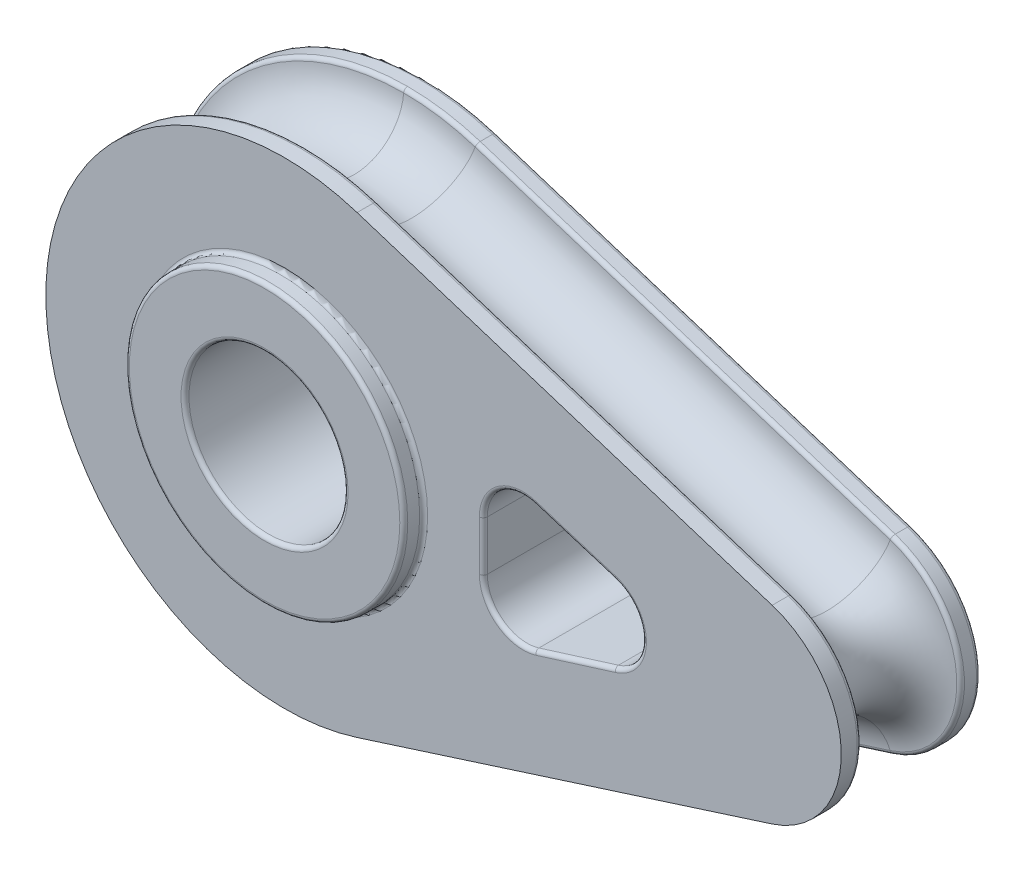
from build123d import *

# Parameters (mm, degrees)
SKETCH1_R           = 88.9
BOSS_EXTRUDE1_DEPTH = 44.45
SKETCH1_3_R         = 88.9
SKETCH1_3_R_2       = 50.8
BOSS_EXTRUDE2_DEPTH = 57.15
SKETCH5_R           = 31.75
FILLET1_R           = 2.54


with BuildPart() as part:
    # Sketch1 → Boss-Extrude1 (new, symmetric)
    with BuildSketch(Plane.XY):
        with BuildLine():
            Line((46.382608696, -145.170291763), (311.426086957, -60.487621568))
            ThreePointArc((311.426086957, -60.487621568), (355.6, 0), (311.426086957, 60.487621568))
            Line((311.426086957, 60.487621568), (46.382608696, 145.170291763))
            ThreePointArc((46.382608696, 145.170291763), (-152.4, 0), (46.382608696, -145.170291763))
        make_face()
        Circle(SKETCH1_R, mode=Mode.SUBTRACT)
        with BuildLine():
            Line((210.776184826, -24.243791442), (159.976184826, -40.118791442))
            ThreePointArc((159.976184826, -40.118791442), (137.354653453, -36.339543662), (127, -15.875))
            Line((127, -15.875), (127, 15.875))
            ThreePointArc((127, 15.875), (137.354653453, 36.339543662), (159.976184826, 40.118791442))
            Line((159.976184826, 40.118791442), (210.776184826, 24.243791442))
            ThreePointArc((210.776184826, 24.243791442), (228.6, 0), (210.776184826, -24.243791442))
        make_face(mode=Mode.SUBTRACT)
    extrude(amount=BOSS_EXTRUDE1_DEPTH, both=True)

    # Sketch1<3> → Boss-Extrude2 (add, symmetric)
    with BuildSketch(Plane.XY):
        Circle(SKETCH1_3_R)
        Circle(SKETCH1_3_R_2, mode=Mode.SUBTRACT)
    extrude(amount=BOSS_EXTRUDE2_DEPTH, both=True)

    # Cut-Sweep2: sweep along a curve in space
    with BuildLine() as cut_sweep2_path:
        Line((311.426086957, 60.487621568, 0), (46.382608696, 145.170291763, 0))
        ThreePointArc((46.382608696, 145.170291763, 0), (-152.4, 0, 0), (46.382608696, -145.170291763, 0))
        Line((46.382608696, -145.170291763, 0), (311.426086957, -60.487621568, 0))
        ThreePointArc((311.426086957, -60.487621568, 0), (355.6, 0, 0), (311.426086957, 60.487621568, 0))
    # Sketch5 → Cut-Sweep2 (sweep, cut)
    with BuildSketch(Plane(origin=(0, 0, 0), x_dir=(0, 0, -1), z_dir=(1, 0, 0))):
        with Locations((0, 152.4)):
            Circle(SKETCH5_R)
    sweep(path=cut_sweep2_path.line, mode=Mode.SUBTRACT)

    # Fillet1
    fillet1_edges = [part.edges().sort_by_distance(p)[0] for p in [
        (127, 0, 44.45),
        (-152.4, 0, -44.45),
        (178.904347826, 102.828956666, -44.45),
        (355.6, 0, -44.45),
        (178.904347826, -102.828956666, -44.45),
        (185.376184826, -32.181291442, -44.45),
        (137.354653453, 36.339543662, 44.45),
        (228.6, 0, -44.45),
        (185.376184826, 32.181291442, -44.45),
        (137.354653453, 36.339543662, -44.45),
        (127, 0, -44.45),
        (137.354653453, -36.339543662, -44.45),
        (185.376184826, 32.181291442, 44.45),
        (228.6, 0, 44.45),
        (185.376184826, -32.181291442, 44.45),
        (-88.9, 0, 44.45),
        (-88.9, 0, -57.15),
        (-88.9, 0, -44.45),
        (-50.8, 0, 57.15),
        (-88.9, 0, 57.15),
        (-50.8, 0, -57.15),
        (-152.4, 0, 31.75),
        (-152.4, 0, 31.75),
        (-152.4, 0, -31.75),
        (-152.4, 0, -31.75),
        (178.904347826, 102.828956666, -31.75),
        (178.904347826, 102.828956666, 31.75),
        (178.904347826, -102.828956666, 31.75),
        (178.904347826, -102.828956666, -31.75),
        (355.6, 0, -31.75),
        (355.6, 0, 31.75),
        (137.354653453, -36.339543662, 44.45),
    ]]
    fillet(fillet1_edges, radius=FILLET1_R)


solid = part.part
